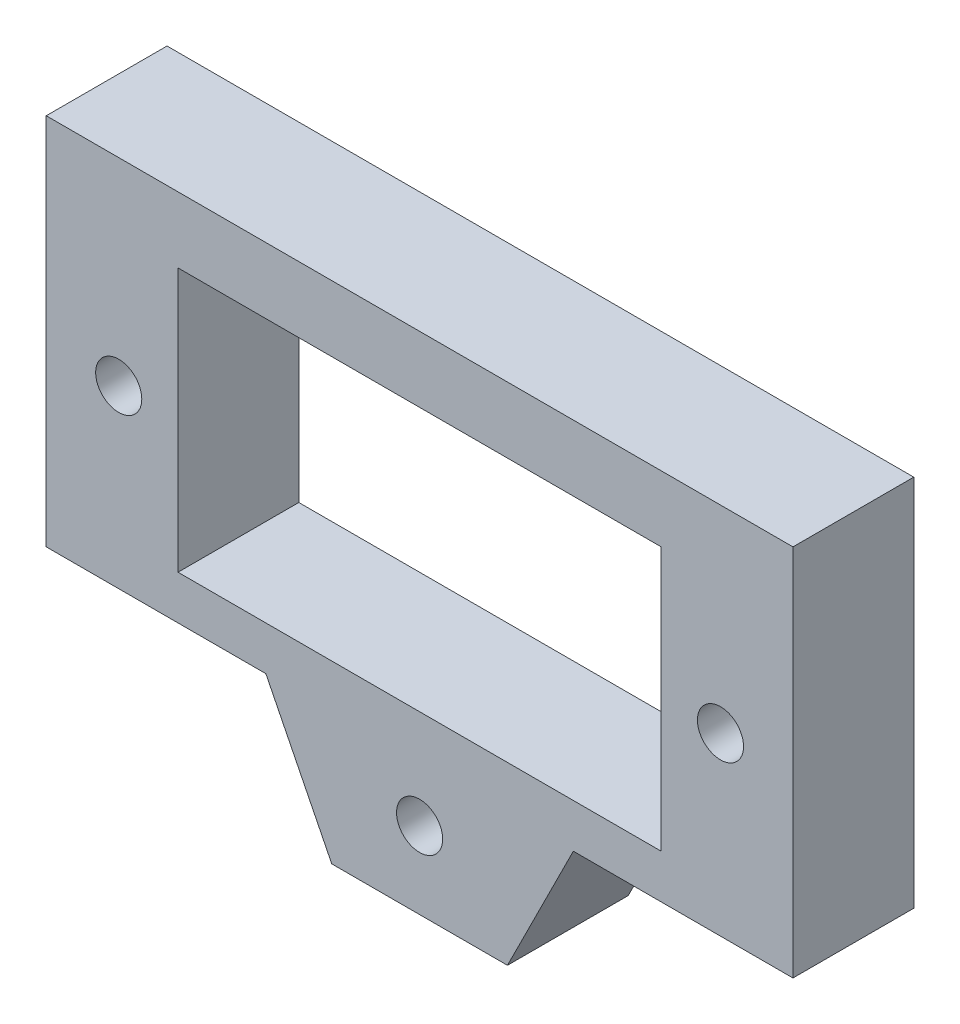
from build123d import *

# Parameters (mm, degrees)
SKETCH_1_R      = 1.05
SKETCH_1_W      = 22
SKETCH_1_H      = 12
EXTRUDE_1_DEPTH = 5.5


with BuildPart() as part:
    # ｽｹｯﾁ1 → ﾎﾞｽ - 押し出し1 (new body)
    with BuildSketch(Plane.XY):
        Polygon((-17, -8), (-7, -8), (-4, -14), (4, -14), (7, -8), (17, -8), (17, 9), (-17, 9), align=None)
        with Locations((-13.7, 0)):
            Circle(SKETCH_1_R, mode=Mode.SUBTRACT)
        with Locations((13.7, 0)):
            Circle(SKETCH_1_R, mode=Mode.SUBTRACT)
        with Locations((0, -10.5)):
            Circle(SKETCH_1_R, mode=Mode.SUBTRACT)
        Rectangle(SKETCH_1_W, SKETCH_1_H, mode=Mode.SUBTRACT)
    extrude(amount=EXTRUDE_1_DEPTH)


solid = part.part
